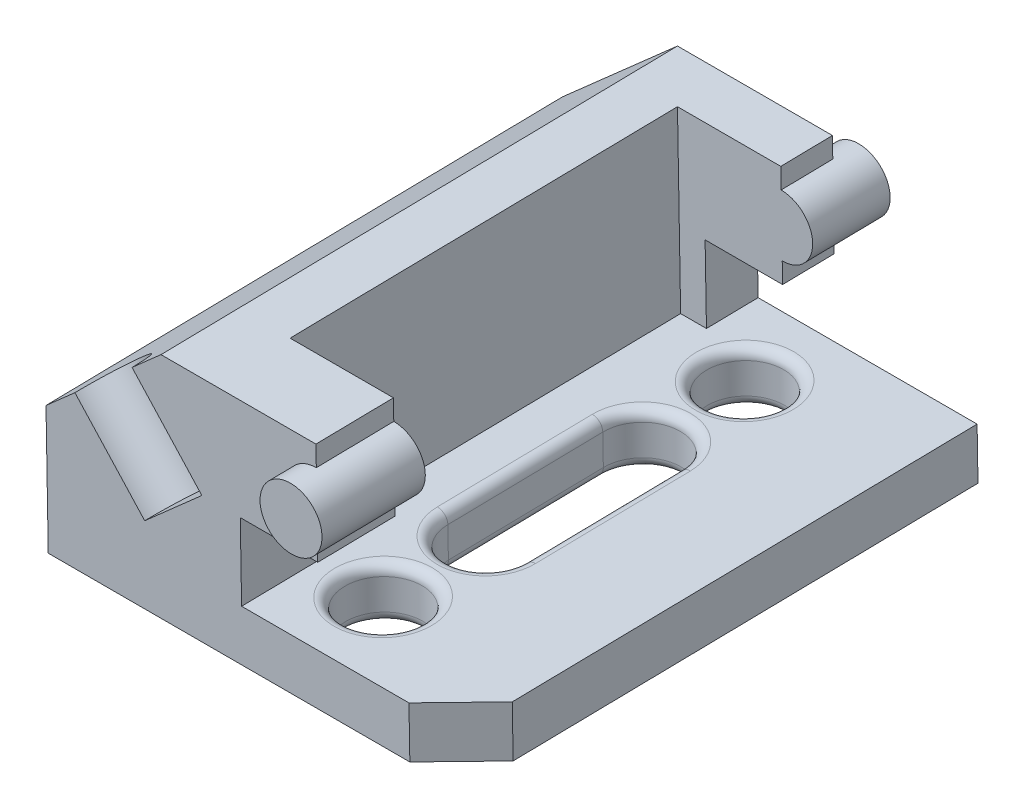
from build123d import *
from build123d.topology import SkipClean

# Parameters (mm, degrees)
SKETCH2_R             = 6
SKETCH2_W             = 37.605887727
SKETCH2_H             = 15
SKETCH2_W_2           = 80
SKETCH2_H_2           = 10
BOSS_EXTRUDE1_DEPTH   = 100
CHAMFER1_SIZE         = 10
CUT_EXTRUDE1_REACH    = 137.739
SKETCH3_W             = 26
SKETCH3_H             = 75
SKETCH4_R             = 6
BOSS_EXTRUDE2_DEPTH   = 5
BOSS_EXTRUDE3_START   = 5
SKETCH5_R             = 6
BOSS_EXTRUDE3_DEPTH   = 5
SKETCH6_R             = 7.5
CUT_EXTRUDE2_DEPTH    = 20
SKETCH7_R             = 7.5
CUT_EXTRUDE3_DEPTH    = 137.565002837
FILLET1_R             = 2
BODY_MOVE_COPY1_ANGLE = 91


with BuildPart() as part:
    # Sketch2 → Boss-Extrude1 (new body)
    with BuildSketch(Plane(origin=(0, 0, 0), x_dir=(1, 0, 0), z_dir=(0, 1, 0))):
        with BuildLine():
            ThreePointArc((58.605887727, 35), (56.848528414, 39.242640687), (52.605887727, 41))
            Line((52.605887727, 41), (52.605887727, 29))
            ThreePointArc((52.605887727, 29), (56.848528414, 30.757359313), (58.605887727, 35))
        make_face()
        with BuildLine():
            Line((52.605887727, 29), (52.605887727, 41))
            ThreePointArc((52.605887727, 41), (46.605887727, 35), (52.605887727, 29))
        make_face()
        with Locations((52.605887727, 35)):
            Circle(SKETCH2_R)
        Polygon((52.605887727, 45), (52.605887727, 25), (37.605887727, 25), (0, 25), (22.605887727, 45), align=None)
        with Locations((18.802943864, 17.5)):
            Rectangle(SKETCH2_W, SKETCH2_H)
        with Locations((40, 5)):
            Rectangle(SKETCH2_W_2, SKETCH2_H_2)
    extrude(amount=BOSS_EXTRUDE1_DEPTH)

    # Chamfer1
    chamfer1_edges = [part.edges().sort_by_distance(p)[0] for p in [
        (80, 100, -5),
    ]]
    chamfer(chamfer1_edges, length=CHAMFER1_SIZE)

    # Cut-Extrude1: up to this face of the body (flat: up to its plane)
    cut_extrude1_end = Plane(part.part.faces().sort_by_distance((58.589742988, 49.443040273, -10))[0])
    # Sketch3 → Cut-Extrude1 (cut, up to the picked face)
    with BuildSketch(Plane(origin=(0, 0, -45), x_dir=(-1, 0, 0), z_dir=(0, 0, -1)), mode=Mode.PRIVATE) as cut_extrude1_sk1:
        with Locations((-45.605887727, 47.5)):
            Rectangle(SKETCH3_W, SKETCH3_H)
    cut_extrude1_tool1 = split(extrude(cut_extrude1_sk1.sketch, amount=-CUT_EXTRUDE1_REACH, mode=Mode.PRIVATE), bisect_by=cut_extrude1_end, keep=Keep.BOTH, mode=Mode.PRIVATE)
    add(cut_extrude1_tool1.solids().sort_by(Axis((45.605888, 47.5, -45), (0, 0, 1)))[0], mode=Mode.SUBTRACT)

    # Sketch4 → Boss-Extrude2 (add)
    with BuildSketch(Plane(origin=(0, 100, 0), x_dir=(1, 0, 0), z_dir=(0, 1, 0))):
        with Locations(Location((52.605887727, 35, 0), (0, 0, 270))):
            Circle(SKETCH4_R)
    extrude(amount=BOSS_EXTRUDE2_DEPTH)

    # Sketch5 → Boss-Extrude3 (add)
    with BuildSketch(Plane(origin=(0, 0, 0), x_dir=(-1, 0, 0), z_dir=(0, -1, 0)).offset(BOSS_EXTRUDE3_START)):
        with Locations(Location((-52.605887727, 35, 0), (0, 0, 90))):
            Circle(SKETCH5_R)
    extrude(amount=-BOSS_EXTRUDE3_DEPTH)

    # Sketch6 → Cut-Extrude2 (cut)
    with BuildSketch(Plane(origin=(-12.406826896, 0, -14.023366793), x_dir=(-0.7489557207890034, 0, 0.6626200482157362), z_dir=(-0.6626200482157362, 0, -0.7489557207890034))):
        with Locations((-31.657106156, 100)):
            Circle(SKETCH6_R)
    extrude(amount=-CUT_EXTRUDE2_DEPTH, mode=Mode.SUBTRACT)

    # Sketch7 → Cut-Extrude3 (cut, through all)
    with SkipClean():  # the faces are left unmerged after this step: merging them gives an invalid solid
        with BuildSketch(Plane(origin=(0, 0, -10), x_dir=(-1, 0, 0), z_dir=(0, 0, -1))):
            with Locations((-50, 85)):
                Circle(SKETCH7_R)
            with Locations((-50, 15)):
                Circle(SKETCH7_R)
            with BuildLine():
                Line((-57.5, 35), (-57.5, 65))
                ThreePointArc((-57.5, 65), (-50, 72.5), (-42.5, 65))
                Line((-42.5, 65), (-42.5, 35))
                ThreePointArc((-42.5, 35), (-50, 27.5), (-57.5, 35))
            make_face()
        extrude(amount=-CUT_EXTRUDE3_DEPTH, mode=Mode.SUBTRACT)

    # Fillet1
    fillet1_edges = [part.edges().sort_by_distance(p)[0] for p in [
        (57.5, 85, 0),
        (57.5, 85, -10),
        (57.5, 15, 0),
        (57.5, 15, -10),
        (50, 27.5, 0),
        (57.5, 50, 0),
        (50, 72.5, 0),
        (42.5, 50, 0),
        (50, 27.5, -10),
        (42.5, 50, -10),
        (50, 72.5, -10),
        (57.5, 50, -10),
    ]]
    fillet(fillet1_edges, radius=FILLET1_R)


with BuildPart() as part_1:
    # Body-Move/Copy1: moved
    add(part.part.rotate(Axis((0, 50, -22.5), (1, 0, 0)), BODY_MOVE_COPY1_ANGLE))


solid = part_1.part
